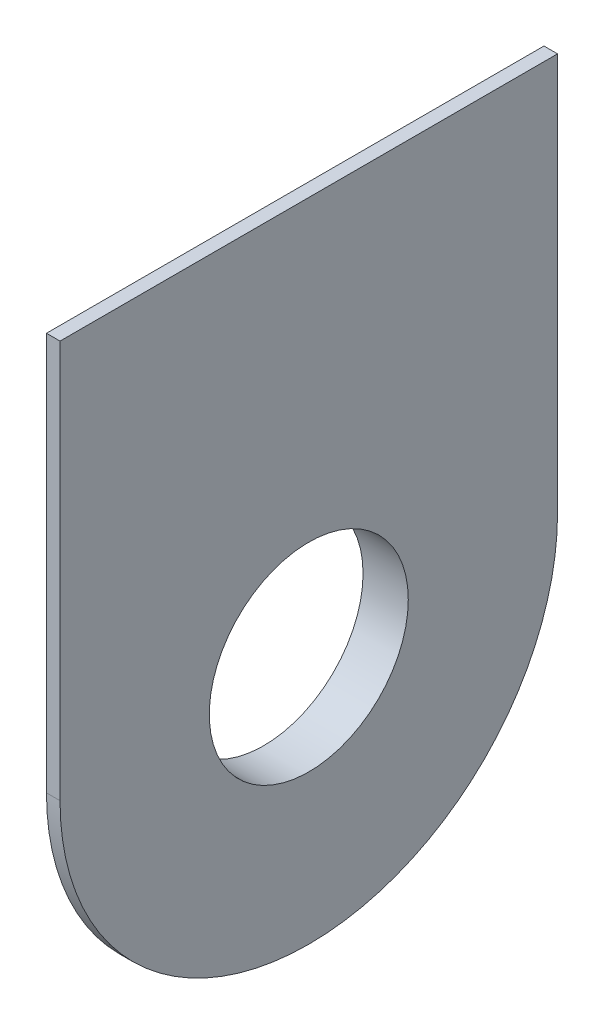
from build123d import *

# Parameters (mm, degrees)
BEARING_START             = 1
SKETCH1_R                 = 25
SKETCH1_R_2               = 22
BEARING_RING_INSERT_DEPTH = 7
SKETCH2_R                 = 22
BULK_EXTRUDE_DEPTH        = 3


with BuildPart() as part:
    # Sketch1 → BEARING RING INSERT (new body)
    with BuildSketch(Plane(origin=(74, 0, 0), x_dir=(0, 0, -1), z_dir=(1, 0, 0)).offset(BEARING_START)):
        with Locations((50, -18.372727273)):
            Circle(SKETCH1_R)
        with Locations((50, -18.372727273)):
            Circle(SKETCH1_R_2, mode=Mode.SUBTRACT)
    extrude(amount=BEARING_RING_INSERT_DEPTH)

    # Sketch2 → BULK EXTRUDE (add)
    with BuildSketch(Plane(origin=(82, 0, 0), x_dir=(0, 0, -1), z_dir=(1, 0, 0))):
        with BuildLine():
            Line((105, -18.372727273), (105, 69.627272727))
            Line((105, 69.627272727), (-5, 69.627272727))
            Line((-5, 69.627272727), (-5, -18.372727273))
            ThreePointArc((-5, -18.372727273), (50, -73.372727273), (105, -18.372727273))
        make_face()
        with Locations((50, -18.372727273)):
            Circle(SKETCH2_R, mode=Mode.SUBTRACT)
    extrude(amount=BULK_EXTRUDE_DEPTH)


solid = part.part
